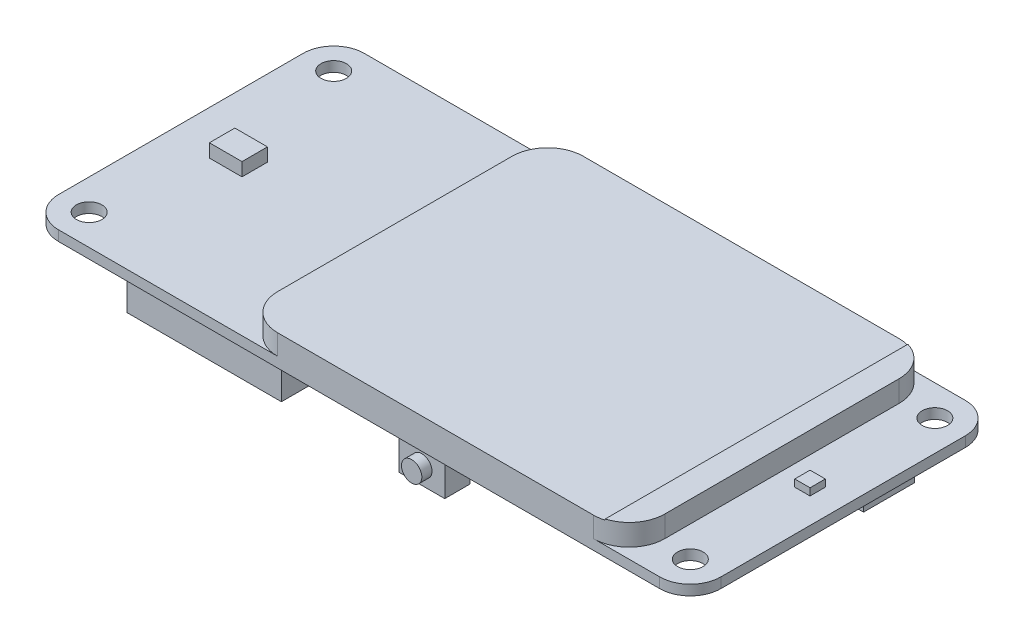
from build123d import *

# Parameters (mm, degrees)
SKETCH_1_R       = 1.25
BOARD_DEPTH      = 1
SKETCH_2_W       = 38
SKETCH_2_H       = 30
SCREEN_DEPTH     = 2
SCREEN_RADIUS_R  = 3.5
SKETCH_3_W       = 51
SKETCH_3_H       = 5
PLUG_DEPTH       = 7.5
SKETCH_4_W       = 15.14
SKETCH_4_H       = 20
SPEAKER_DEPTH    = 5
SKETCH_5_W       = 4.5
SKETCH_5_H       = 2.5
BUTTON_DEPTH     = 3.4
SKETCH_6_R       = 1
BUTTON_TAP_DEPTH = 1
SKETCH_7_W       = 1.5
SKETCH_7_H       = 1.5
RGB_LED_DEPTH    = 0.7
SKETCH_8_W       = 3.2
SKETCH_8_H       = 2.5
MIC_DEPTH        = 1.3
EXTRUDE_START    = 0.1
EXTRUDE_1_DEPTH  = 0.1


with BuildPart() as part:
    # 草图1 → board (new body)
    with BuildSketch(Plane(origin=(0, 0, 0), x_dir=(1, 0, 0), z_dir=(0, 1, 0))):
        with BuildLine():
            Line((-29.5, 15), (29.5, 15))
            ThreePointArc((29.5, 15), (31.621320344, 14.121320344), (32.5, 12))
            Line((32.5, 12), (32.5, -12))
            ThreePointArc((32.5, -12), (31.621320344, -14.121320344), (29.5, -15))
            Line((29.5, -15), (-29.5, -15))
            ThreePointArc((-29.5, -15), (-31.621320344, -14.121320344), (-32.5, -12))
            Line((-32.5, -12), (-32.5, 12))
            ThreePointArc((-32.5, 12), (-31.621320344, 14.121320344), (-29.5, 15))
        make_face()
        with Locations(Location((-29.5, 12, 0), (0, 0, 270))):
            Circle(SKETCH_1_R, mode=Mode.SUBTRACT)
        with Locations(Location((29.5, 12, 0), (0, 0, 270))):
            Circle(SKETCH_1_R, mode=Mode.SUBTRACT)
        with Locations(Location((-29.5, -12, 0), (0, 0, 270))):
            Circle(SKETCH_1_R, mode=Mode.SUBTRACT)
        with Locations(Location((29.5, -12, 0), (0, 0, 270))):
            Circle(SKETCH_1_R, mode=Mode.SUBTRACT)
    extrude(amount=BOARD_DEPTH)

    # 草图2 → screen (add)
    with BuildSketch(Plane(origin=(0, 1, 0), x_dir=(1, 0, 0), z_dir=(0, 1, 0))):
        with Locations((7.5, 0)):
            Rectangle(SKETCH_2_W, SKETCH_2_H)
    extrude(amount=SCREEN_DEPTH)

    # screen-radius
    screen_radius_edges = [part.edges().sort_by_distance(p)[0] for p in [
        (-11.5, 2, -15),
        (-11.5, 2, 15),
        (26.5, 2, 15),
        (26.5, 2, -15),
    ]]
    fillet(screen_radius_edges, radius=SCREEN_RADIUS_R)

    # 草图3 → plug (add)
    with BuildSketch(Plane.XZ):
        with Locations((0, -11.5)):
            Rectangle(SKETCH_3_W, SKETCH_3_H)
    extrude(amount=PLUG_DEPTH)

    # 草图4 → speaker (add)
    with BuildSketch(Plane.XZ):
        with Locations((-17.52, 2.68)):
            Rectangle(SKETCH_4_W, SKETCH_4_H)
    extrude(amount=SPEAKER_DEPTH)

    # 草图5 → button (add)
    with BuildSketch(Plane.XZ):
        with Locations((5.65, 13.25)):
            Rectangle(SKETCH_5_W, SKETCH_5_H)
    extrude(amount=BUTTON_DEPTH)

    # 草图6 → button-tap (add)
    with BuildSketch(Plane.XY.offset(14.5)):
        with Locations(Location((5.65, -1.7, 0), (0, 0, 180))):
            Circle(SKETCH_6_R)
    extrude(amount=BUTTON_TAP_DEPTH)

    # 草图7 → rgb-led (add)
    with BuildSketch(Plane(origin=(0, 1, 0), x_dir=(1, 0, 0), z_dir=(0, 1, 0))):
        with Locations((29.25, 0)):
            Rectangle(SKETCH_7_W, SKETCH_7_H)
    extrude(amount=RGB_LED_DEPTH)

    # 草图8 → mic (add)
    with BuildSketch(Plane(origin=(0, 1, 0), x_dir=(1, 0, 0), z_dir=(0, 1, 0))):
        with Locations((-26.6, -0.25)):
            Rectangle(SKETCH_8_W, SKETCH_8_H)
    extrude(amount=MIC_DEPTH)

    # 草图9 → 凸台-拉伸1 (add)
    with BuildSketch(Plane(origin=(0, 3, 0), x_dir=(1, 0, 0), z_dir=(0, 1, 0)).offset(EXTRUDE_START)):
        with BuildLine():
            Line((26.5, -11.5), (26.5, 11.5))
            ThreePointArc((26.5, 11.5), (25.80624304, 13.591650066), (24, 14.854101966))
            Line((24, 14.854101966), (24, -14.854101966))
            ThreePointArc((24, -14.854101966), (25.80624304, -13.591650066), (26.5, -11.5))
        make_face()
    extrude(amount=-EXTRUDE_1_DEPTH)


solid = part.part
